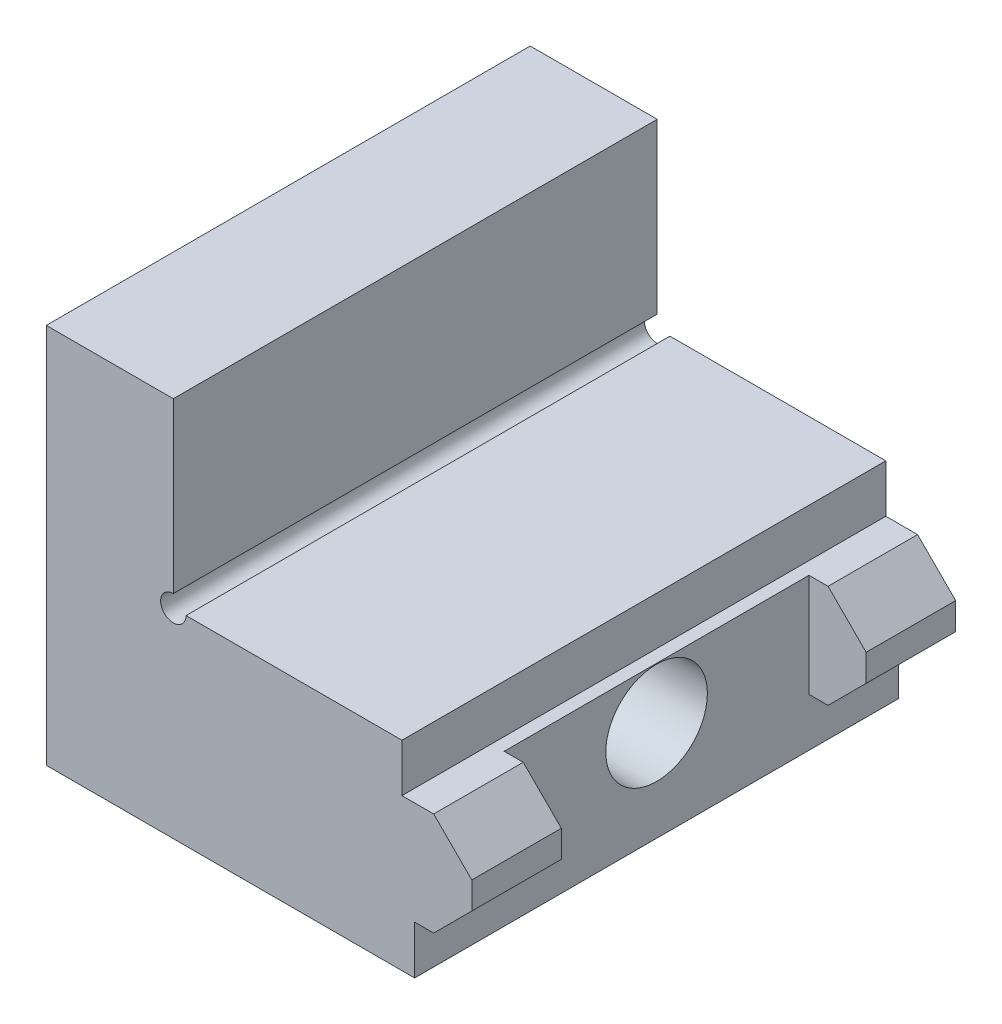
from build123d import *

# Parameters (mm, degrees)
BOSS_EXTRUDE1_DEPTH     = 38.1
CUT_EXTRUDE1_DEPTH      = 55.4
CUT_EXTRUDE1_DEPTH_BACK = 30
SKETCH2_R               = 4
SKETCH3_R               = 6.5
CUT_EXTRUDE2_DEPTH      = 18.2
CUT_EXTRUDE3_START      = 19
SKETCH4_W               = 24
SKETCH4_H               = 20
CUT_EXTRUDE3_DEPTH      = 10
CHAMFER1_SIZE           = 3


with BuildPart() as part:
    # Sketch1 → Boss-Extrude1 (new body)
    with BuildSketch(Plane.XY):
        with BuildLine():
            Line((-10, -15.714961024), (-10, 14.285038976))
            Line((-10, 14.285038976), (0, 14.285038976))
            Line((0, 14.285038976), (0, 1))
            ThreePointArc((0, 1), (-0.707106781, -0.707106781), (1, 0))
            Line((1, 0), (18, 0))
            Line((18, 0), (18, -3.779961024))
            Line((18, -3.779961024), (23.5, -3.779961024))
            Line((23.5, -3.779961024), (23.5, -11.899961024))
            Line((23.5, -11.899961024), (19, -11.899961024))
            Line((19, -11.899961024), (19, -15.714961024))
            Line((19, -15.714961024), (-10, -15.714961024))
        make_face()
    extrude(amount=-BOSS_EXTRUDE1_DEPTH)

    # Sketch2 → Cut-Extrude1 (cut, two sides: drawn at the far end of the back side and taken through both)
    with BuildSketch(Plane(origin=(0, 0, 0), x_dir=(0, 0, -1), z_dir=(1, 0, 0)).offset(-CUT_EXTRUDE1_DEPTH_BACK)):
        with Locations((-19.05, -7.839961024)):
            Circle(SKETCH2_R)
        with Locations((19.05, -7.839961024)):
            Circle(SKETCH2_R)
    extrude(amount=CUT_EXTRUDE1_DEPTH + CUT_EXTRUDE1_DEPTH_BACK, mode=Mode.SUBTRACT)

    # Sketch3 → Cut-Extrude2 (cut)
    with BuildSketch(Plane(origin=(0, 0, 0), x_dir=(0, 0, -1), z_dir=(1, 0, 0))):
        with Locations((19.05, -7.839961024)):
            Circle(SKETCH3_R)
    extrude(amount=-CUT_EXTRUDE2_DEPTH, mode=Mode.SUBTRACT)

    # Sketch4 → Cut-Extrude3 (cut)
    with BuildSketch(Plane(origin=(0, 0, 0), x_dir=(0, 0, -1), z_dir=(1, 0, 0)).offset(CUT_EXTRUDE3_START)):
        with Locations((19.05, -7.839961024)):
            Rectangle(SKETCH4_W, SKETCH4_H)
    extrude(amount=CUT_EXTRUDE3_DEPTH, mode=Mode.SUBTRACT)

    # Chamfer1
    chamfer1_edges = [part.edges().sort_by_distance(p)[0] for p in [
        (23.5, -3.779961024, -34.575),
        (23.5, -11.899961024, -34.575),
        (23.5, -11.899961024, -3.525),
        (23.5, -3.779961024, -3.525),
    ]]
    chamfer(chamfer1_edges, length=CHAMFER1_SIZE)


solid = part.part
